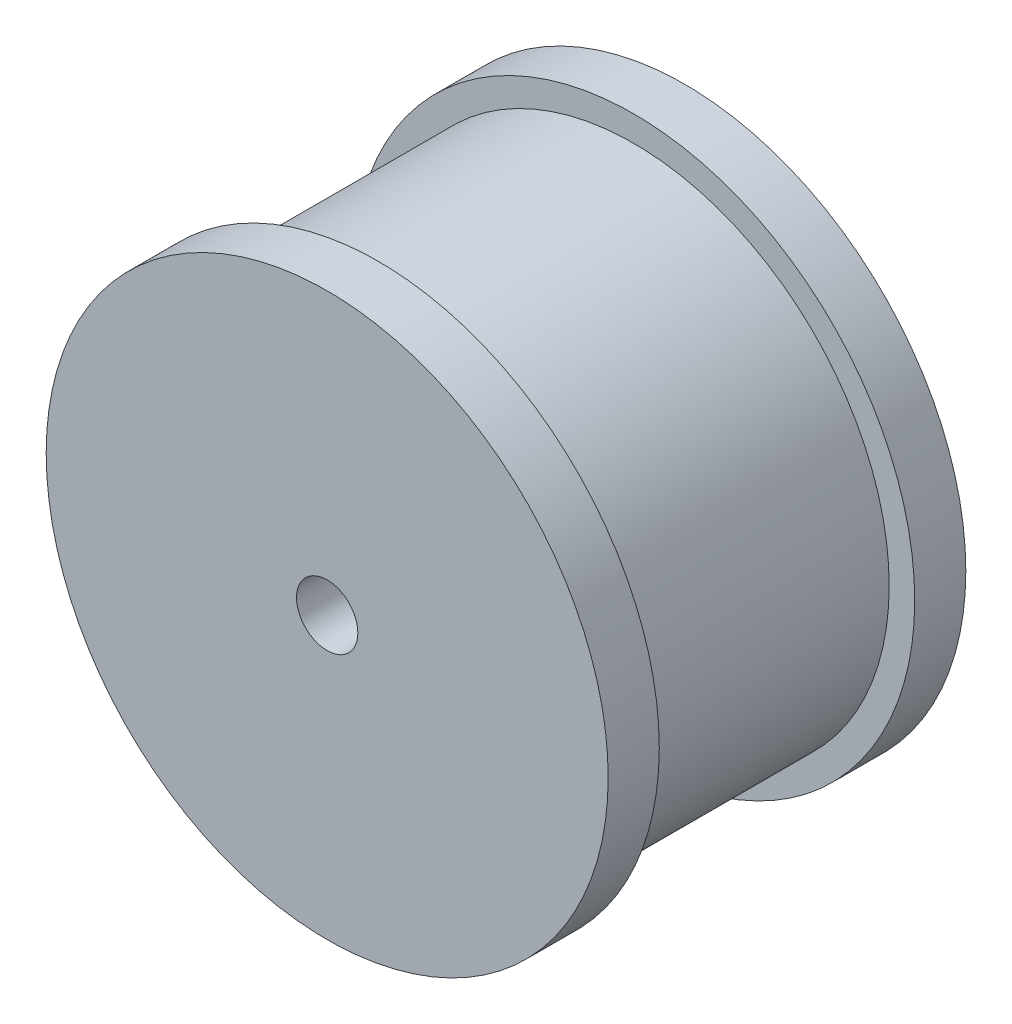
from build123d import *

# Parameters (mm, degrees)
SKETCH1_R           = 25
SKETCH1_R_2         = 3
BOSS_EXTRUDE1_DEPTH = 25
SKETCH2_R           = 27.5
SKETCH2_R_2         = 3
BOSS_EXTRUDE2_DEPTH = 5
BOSS_EXTRUDE3_START = 5
SKETCH3_R           = 27.5
SKETCH3_R_2         = 3
BOSS_EXTRUDE3_DEPTH = 5


with BuildPart() as part:
    # Sketch1 → Boss-Extrude1 (new body)
    with BuildSketch(Plane.XY):
        Circle(SKETCH1_R)
        Circle(SKETCH1_R_2, mode=Mode.SUBTRACT)
    extrude(amount=BOSS_EXTRUDE1_DEPTH)

    # Sketch2 → Boss-Extrude2 (add)
    with BuildSketch(Plane.XY.offset(25)):
        Circle(SKETCH2_R)
        Circle(SKETCH2_R_2, mode=Mode.SUBTRACT)
    extrude(amount=BOSS_EXTRUDE2_DEPTH)

    # Sketch3 → Boss-Extrude3 (add)
    with BuildSketch(Plane(origin=(0, 0, 0), x_dir=(-1, 0, 0), z_dir=(0, 0, -1)).offset(BOSS_EXTRUDE3_START)):
        with Locations(Location((0, 0, 0), (0, 0, 180))):
            Circle(SKETCH3_R)
        Circle(SKETCH3_R_2, mode=Mode.SUBTRACT)
    extrude(amount=-BOSS_EXTRUDE3_DEPTH)


solid = part.part
